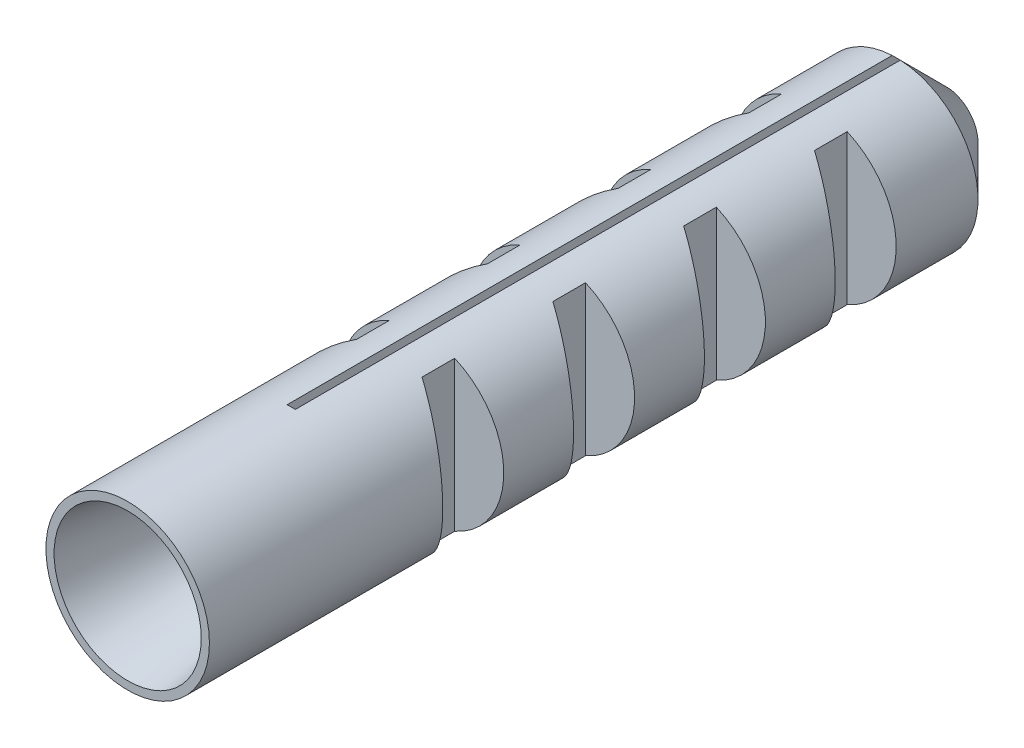
from build123d import *

# Parameters (mm, degrees)
SKETCH1_R               = 5
BOSS_EXTRUDE1_DEPTH     = 50
CUT_EXTRUDE1_DEPTH      = 51.497524692
CUT_EXTRUDE1_DEPTH_BACK = 51.497524692
SKETCH2_W               = 0.5
SKETCH2_H               = 40
CHAMFER1_SIZE           = 3


with BuildPart() as part:
    # Sketch1 → Boss-Extrude1 (new body)
    with BuildSketch(Plane.XY):
        Circle(SKETCH1_R)
    extrude(amount=BOSS_EXTRUDE1_DEPTH)

    # Sketch2 → Cut-Extrude1 (cut, two sides: drawn at the far end of the back side and taken through both)
    with BuildSketch(Plane(origin=(0, 0, 0), x_dir=(1, 0, 0), z_dir=(0, 1, 0)).offset(-CUT_EXTRUDE1_DEPTH_BACK)):
        with Locations((0, -20)):
            Rectangle(SKETCH2_W, SKETCH2_H)
        Polygon((-5, -8), (-2, -8), (-2, -10), (-5, -11.732050808), align=None)
        Polygon((2, -10), (5, -11.732050808), (5, -8), (2, -8), align=None)
        Polygon((-5, -16), (-2, -16), (-2, -18), (-5, -19.732050808), align=None)
        Polygon((2, -16), (2, -18), (5, -19.732050808), (5, -16), align=None)
        Polygon((-5, -24), (-2, -24), (-2, -26), (-5, -27.732050808), align=None)
        Polygon((2, -24), (2, -26), (5, -27.732050808), (5, -24), align=None)
        Polygon((-5, -32), (-2, -32), (-2, -34), (-5, -35.732050808), align=None)
        Polygon((2, -32), (2, -34), (5, -35.732050808), (5, -32), align=None)
    extrude(amount=CUT_EXTRUDE1_DEPTH + CUT_EXTRUDE1_DEPTH_BACK, mode=Mode.SUBTRACT)

    # Chamfer1
    chamfer1_edges = [part.edges().sort_by_distance(p)[0] for p in [
        (-5, 0, 0),
        (3.622844187, -3.446012188, 0),
    ]]
    chamfer(chamfer1_edges, length=CHAMFER1_SIZE)

    # Cut-Extrude2 cone 1 section (through the dimple's axis) → Cut-Extrude2 (revolve, cut)
    with BuildSketch(Plane(origin=(0, 0, 50), x_dir=(0, -1, 0), z_dir=(1, 0, 0))):
        Polygon((0, 0), (4.5, 0), (0, 25.520768188), align=None)
    revolve(axis=Axis((0, 0, 50), (0, 0, -1)), mode=Mode.SUBTRACT)


solid = part.part
